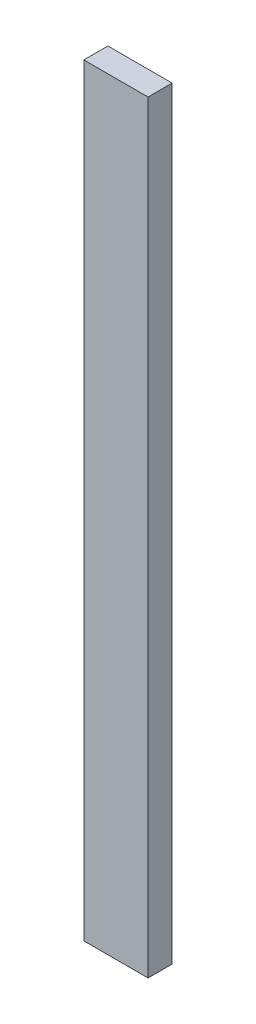
from build123d import *

# Parameters (mm, degrees)
SKETCH2_W           = 50.8
SKETCH2_H           = 603.25
BOSS_EXTRUDE1_DEPTH = 19.05


with BuildPart() as part:
    # Sketch2 → Boss-Extrude1 (new body)
    with BuildSketch(Plane.XY):
        Rectangle(SKETCH2_W, SKETCH2_H)
    extrude(amount=BOSS_EXTRUDE1_DEPTH)


solid = part.part
